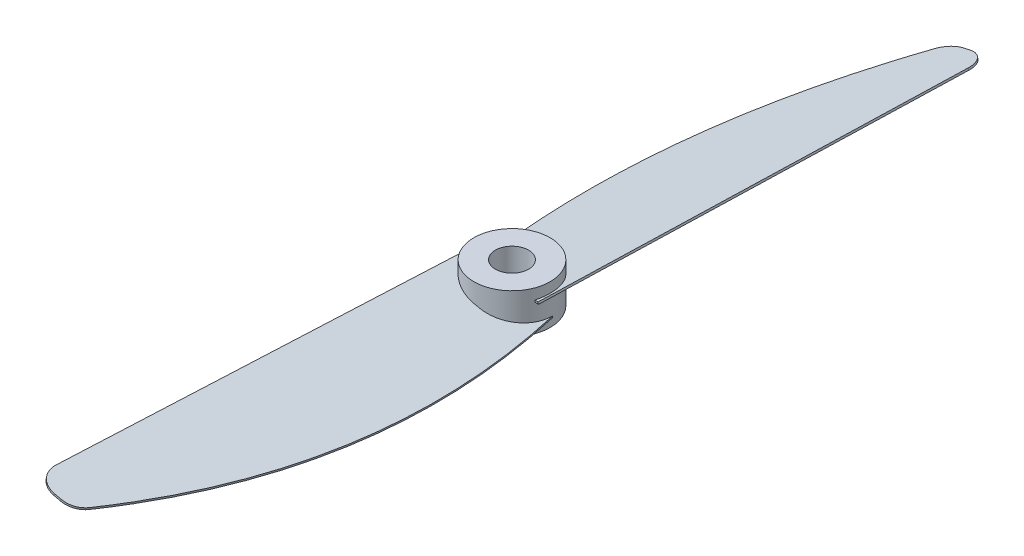
from build123d import *

# Parameters (mm, degrees)
SKETCH1_R           = 5.75
BOSS_EXTRUDE1_DEPTH = 3
BOSS_EXTRUDE2_DEPTH = 0.15
CIRPATTERN1_COUNT   = 2
SKETCH4_R           = 2.5
CUT_EXTRUDE1_DEPTH  = 65.351390501


with BuildPart() as part:
    # Sketch1 → Boss-Extrude1 (new, symmetric)
    with BuildSketch(Plane(origin=(0, 0, 0), x_dir=(1, 0, 0), z_dir=(0, 1, 0))):
        with Locations(Location((0, 0, 0), (0, 0, 270))):
            Circle(SKETCH1_R)
    extrude(amount=BOSS_EXTRUDE1_DEPTH, both=True)

    # Sketch3 → Boss-Extrude2 (add, symmetric)
    with BuildSketch(Plane(origin=(0, 0, 0), x_dir=(0.9743700647852351, -0.22495105434386545, 0), z_dir=(-0.22495105434386545, -0.9743700647852351, 0))):
        with BuildLine():
            Line((-4.681329955, -1.686621276), (-6.216630979, -2.101445918))
            Line((-6.216630979, -2.101445918), (-8.722778735, 60.379765414))
            ThreePointArc((-8.722778735, 60.379765414), (-7.888601188, 62.578376319), (-5.725189096, 63.5))
            Line((-5.725189096, 63.5), (-4.654387641, 63.5))
            ThreePointArc((-4.654387641, 63.5), (-3.079032897, 63.053087823), (-1.973041632, 61.845504954))
            add(Edge.make_bspline(
                [(6.277481036, 0), (10.594464488, 21.617209899), (7.832639592, 42.304570426), (-1.973041632, 61.845504954)],
                knots=[0, 0, 0, 0, 0.972510394, 0.972510394, 0.972510394, 0.972510394], degree=3))
            add(Edge.make_bspline(
                [(6.277481036, 0), (6.277481036, 6.676569572), (-0.15603138, 5.686416632), (-6.589543796, 4.696263693), (-4.681329955, -1.686621276)],
                knots=[4.71238898, 4.71238898, 4.71238898, 6.432037026, 6.432037026, 8.151685071, 8.151685071, 8.151685071], degree=2, weights=[1, 0.652570821, 1, 0.652570821, 1]))
        make_face()
    boss_extrude2 = extrude(amount=BOSS_EXTRUDE2_DEPTH, both=True)

    # CirPattern1: Boss-Extrude2 ×2 about axis
    cirpattern1_axis = Axis((0, 3, 0), (0, -1, 0))
    for i in range(1, CIRPATTERN1_COUNT):
        add(boss_extrude2.rotate(cirpattern1_axis, i * 360 / CIRPATTERN1_COUNT))

    # Sketch4 → Cut-Extrude1 (cut, through all)
    with BuildSketch(Plane.XZ.offset(3)):
        with Locations(Location((0, 0, 0), (0, 0, 270))):
            Circle(SKETCH4_R)
    extrude(amount=-CUT_EXTRUDE1_DEPTH, mode=Mode.SUBTRACT)


solid = part.part
